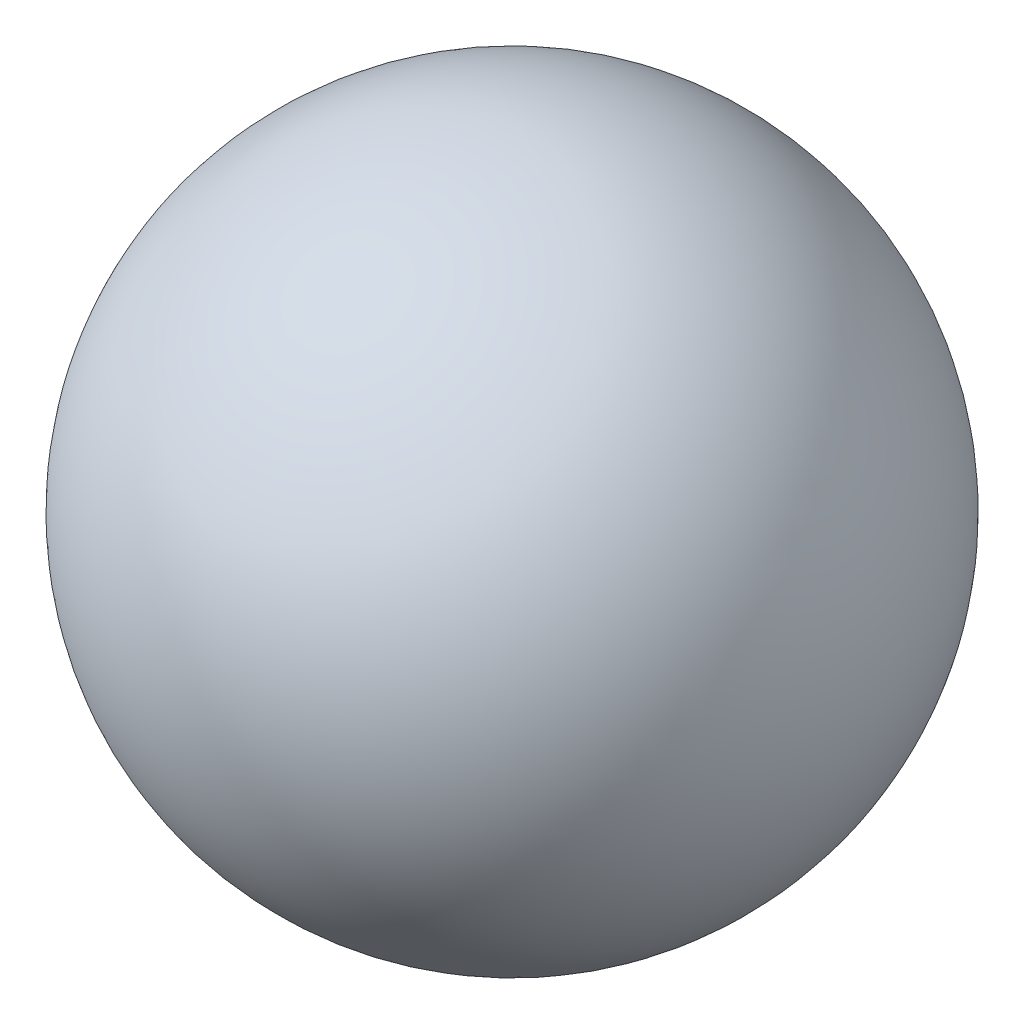
from build123d import *


with BuildPart() as part:
    # 草图1 → 旋转6 (revolve)
    with BuildSketch(Plane.XY):
        with BuildLine():
            Line((32, 0), (-32, 0))
            ThreePointArc((-32, 0), (0, 32), (32, 0))
        make_face()
    revolve(axis=Axis((32, 0, 0), (-1, 0, 0)))


solid = part.part
